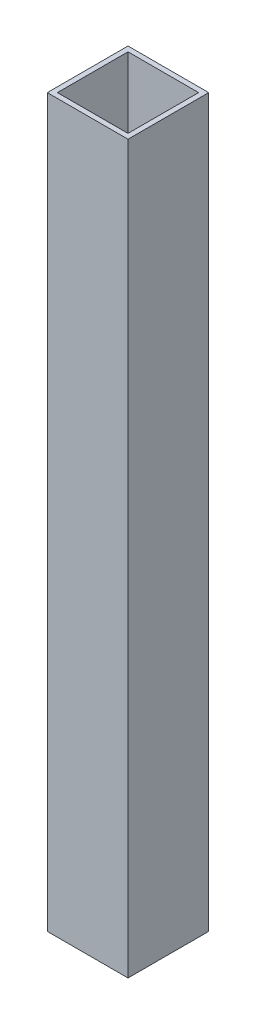
from build123d import *

# Parameters (mm, degrees)
SKETCH1_W           = 25.4
SKETCH1_H           = 25.4
SKETCH1_W_2         = 22.225
SKETCH1_H_2         = 22.225
BOSS_EXTRUDE1_DEPTH = 228.6


with BuildPart() as part:
    # Sketch1 → Boss-Extrude1 (new body)
    with BuildSketch(Plane(origin=(0, 0, 0), x_dir=(1, 0, 0), z_dir=(0, 1, 0))):
        Rectangle(SKETCH1_W, SKETCH1_H)
        Rectangle(SKETCH1_W_2, SKETCH1_H_2, mode=Mode.SUBTRACT)
    extrude(amount=BOSS_EXTRUDE1_DEPTH)


solid = part.part
